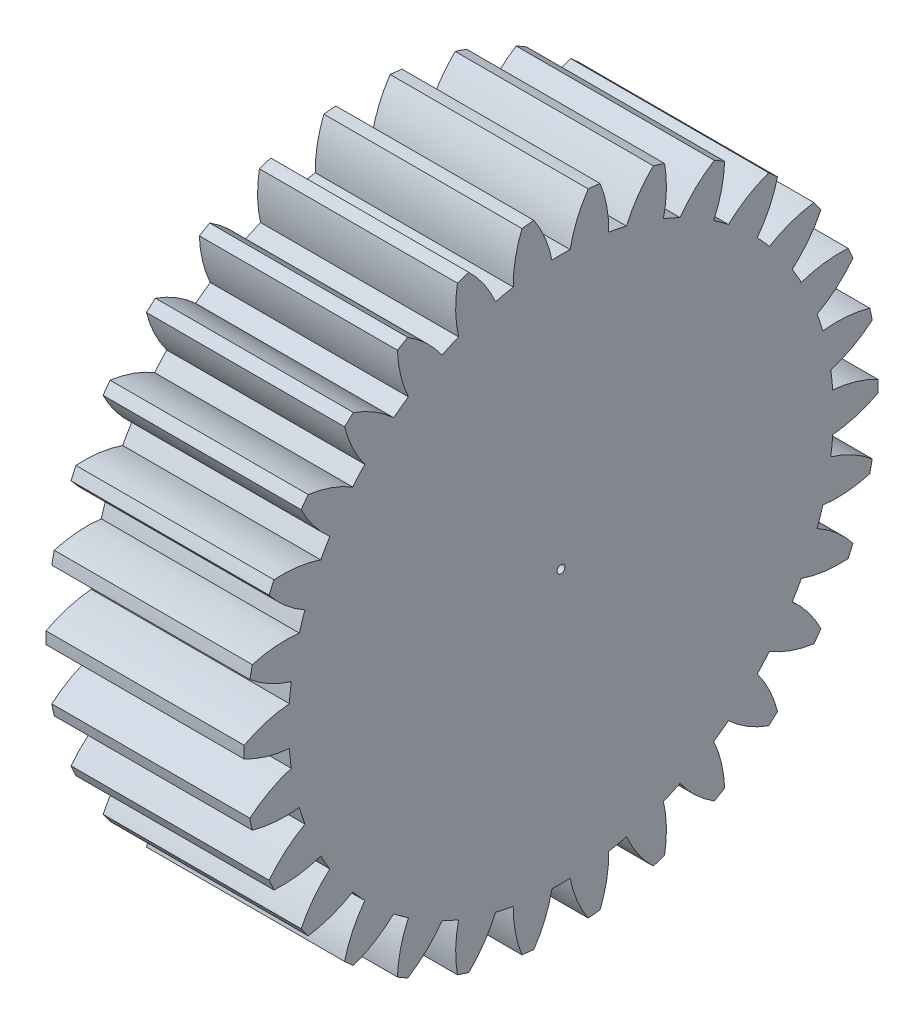
from build123d import *

# Parameters (mm, degrees)
BASPROSKE_W     = 20
BASPROSKE_H     = 32
TOOTHCUT_DEPTH  = 50.477267507
TEETHCUTS_COUNT = 30
TEETHCUTS_ANGLE = 348
BORSKE_R        = 0.4
BORE_DEPTH      = 50.0000508


with BuildPart() as part:
    # BasProSke → Base-Revolve (revolve)
    with BuildSketch(Plane(origin=(0, 0, 0), x_dir=(1, 0, 0), z_dir=(0, 1, 0)), mode=Mode.PRIVATE) as base_revolve_sk:
        with Locations((10, 16)):
            Rectangle(BASPROSKE_W, BASPROSKE_H)
    revolve(base_revolve_sk.sketch.rotate(Axis((-10, 0, 0), (1, 0, 0)), 180), axis=Axis((-10, 0, 0), (1, 0, 0)))

    # TooCutSke → ToothCut (cut, through all)
    with BuildSketch(Plane(origin=(0, 0, 0), x_dir=(0, 0, -1), z_dir=(1, 0, 0))):
        with BuildLine():
            ThreePointArc((0.918551563, 27.483654488), (0, 27.499), (-0.918551563, 27.483654488))
            ThreePointArc((-0.918551563, 27.483654488), (-1.617208176, 29.787801627), (-2.761784709, 31.906093311))
            ThreePointArc((-2.761784709, 31.906093311), (0, 32.0254), (2.761784709, 31.906093311))
            ThreePointArc((2.761784709, 31.906093311), (1.617208176, 29.787801627), (0.918551563, 27.483654488))
        make_face()
    toothcut = extrude(amount=TOOTHCUT_DEPTH, mode=Mode.SUBTRACT)

    # TeethCuts: ToothCut ×30 about axis
    teethcuts_axis = Axis((-10, 0, 0), (1, 0, 0))
    for i in range(1, TEETHCUTS_COUNT):
        add(toothcut.rotate(teethcuts_axis, i * TEETHCUTS_ANGLE / (TEETHCUTS_COUNT - 1)), mode=Mode.SUBTRACT)

    # BorSke → Bore (cut, symmetric)
    with BuildSketch(Plane(origin=(0, 0, 0), x_dir=(0, 0, -1), z_dir=(1, 0, 0))):
        with Locations(Location((0, 0, 0), (0, 0, 180))):
            Circle(BORSKE_R)
    extrude(amount=BORE_DEPTH, both=True, mode=Mode.SUBTRACT)


solid = part.part
